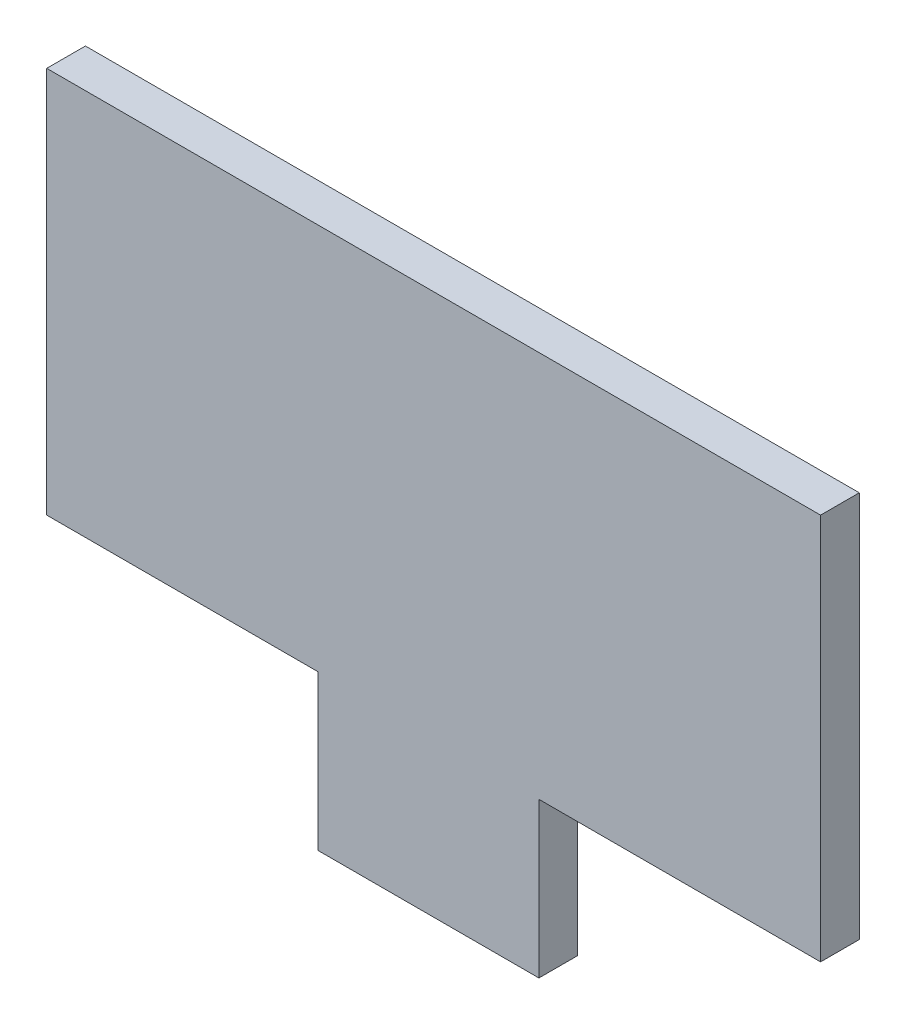
from build123d import *

# Parameters (mm, degrees)
SKETCH1_W           = 50
SKETCH1_H           = 25
SKETCH1_W_2         = 14.25891182
SKETCH1_H_2         = 10
BOSS_EXTRUDE1_DEPTH = 2.5


with BuildPart() as part:
    # Sketch1 → Boss-Extrude1 (new body)
    with BuildSketch(Plane.XY):
        with Locations((26.219512195, 12.781425891)):
            Rectangle(SKETCH1_W, SKETCH1_H)
        with Locations((25.891181989, -4.718574109)):
            Rectangle(SKETCH1_W_2, SKETCH1_H_2)
    extrude(amount=BOSS_EXTRUDE1_DEPTH)


solid = part.part
